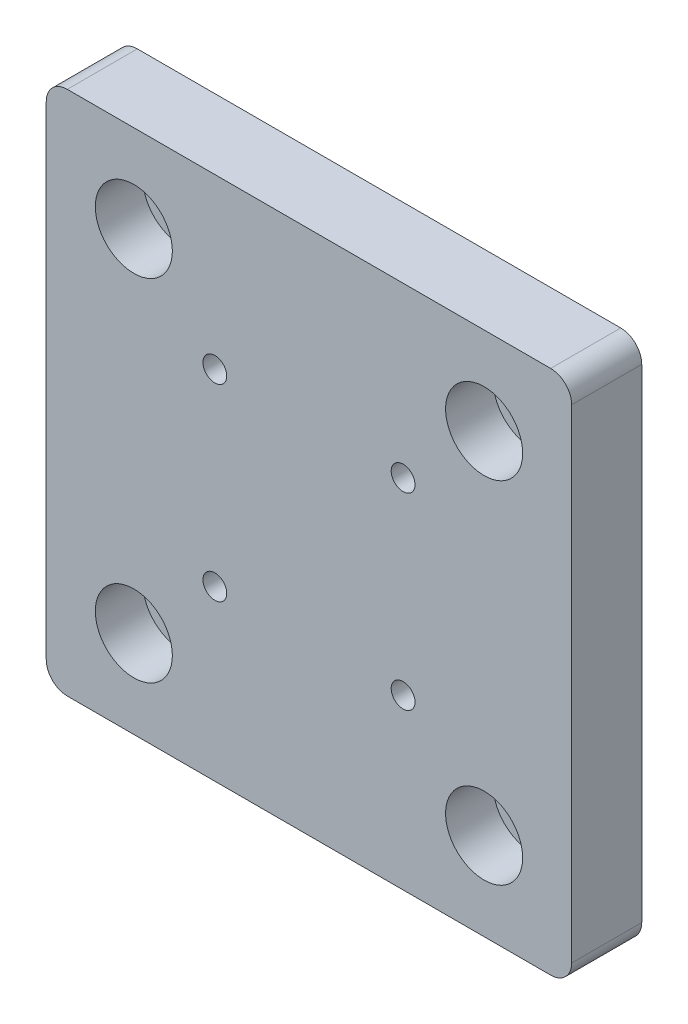
from build123d import *

# Parameters (mm, degrees)
SKETCH_1_W                = 75
SKETCH_1_H                = 75
EXTRUDE_1_DEPTH           = 10
HOLE_WIZARD_1_D           = 6.6
HOLE_WIZARD_1_DEPTH       = 15
HOLE_WIZARD_1_CBORE_D     = 11
HOLE_WIZARD_1_CBORE_DEPTH = 6.8
HOLE_WIZARD_1_TIP         = 1.982840043
FILLET_1_R                = 3
HOLE_WIZARD_2_D           = 3.4
HOLE_WIZARD_2_CBORE_D     = 6
HOLE_WIZARD_2_CBORE_DEPTH = 3.4


with BuildPart() as part:
    # 草图1 → 凸台-拉伸1 (new body)
    with BuildSketch(Plane.XY):
        Rectangle(SKETCH_1_W, SKETCH_1_H)
    extrude(amount=EXTRUDE_1_DEPTH)

    # 打孔尺寸(%根据)内六角圆柱头螺钉的类型1
    with Locations(Plane(origin=(-25, 25, 10), x_dir=(1, 0, 0), z_dir=(0, 0, 1))):
        with Locations((0, 0), (0, -50), (50, -50), (50, 0)):
            CounterBoreHole(HOLE_WIZARD_1_D / 2, HOLE_WIZARD_1_CBORE_D / 2, HOLE_WIZARD_1_CBORE_DEPTH, depth=HOLE_WIZARD_1_DEPTH)
            with Locations((0, 0, -(HOLE_WIZARD_1_DEPTH + HOLE_WIZARD_1_TIP / 2))):  # 118° drill point
                Cone(0, HOLE_WIZARD_1_D / 2, HOLE_WIZARD_1_TIP, mode=Mode.SUBTRACT)

    # 圆角1
    fillet_1_edges = [part.edges().sort_by_distance(p)[0] for p in [
        (37.5, -37.5, 5),
        (-37.5, -37.5, 5),
        (-37.5, 37.5, 5),
        (37.5, 37.5, 5),
    ]]
    fillet(fillet_1_edges, radius=FILLET_1_R)

    # 打孔尺寸(%根据)内六角圆柱头螺钉的类型2 (through all)
    with Locations(Plane(origin=(0, 0, 0), x_dir=(-1, 0, 0), z_dir=(0, 0, -1))):
        with Locations((13.435028843, -13.435028843), (13.435028843, 13.435028843), (-13.435028843, 13.435028843), (-13.435028843, -13.435028843)):
            CounterBoreHole(HOLE_WIZARD_2_D / 2, HOLE_WIZARD_2_CBORE_D / 2, HOLE_WIZARD_2_CBORE_DEPTH)


solid = part.part
